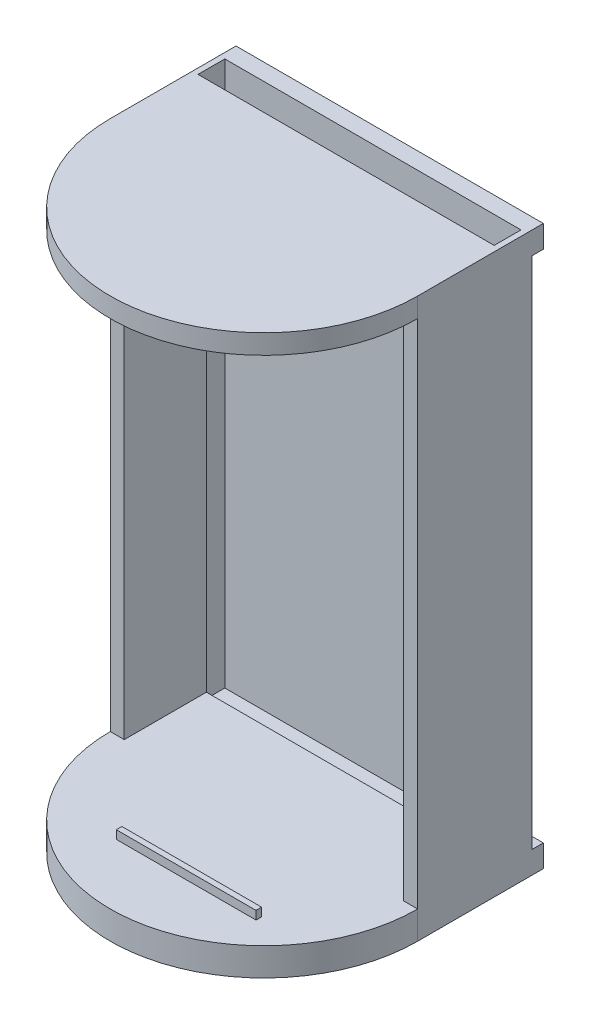
from build123d import *

# Parameters (mm, degrees)
SKETCH_14_W         = 110
SKETCH_14_H         = 200
EXTRUDE_11_DEPTH    = 15
SKETCH_15_W         = 5
SKETCH_15_H         = 200
EXTRUDE_12_DEPTH    = 30
EXTRUDE_14_DEPTH    = 10
EXTRUDE_15_DEPTH    = 7
SKETCH_19_W         = 4
SKETCH_19_H         = 184
CUT_EXTRUDE_1_DEPTH = 190.489445616
SKETCH_22_W         = 50
SKETCH_22_H         = 2
EXTRUDE_17_DEPTH    = 3
SKETCH_23_W         = 50
SKETCH_23_H         = 2
EXTRUDE_18_DEPTH    = 3
SKETCH_24_W         = 106
SKETCH_24_H         = 9.6
CUT_EXTRUDE_2_DEPTH = 195


with BuildPart() as part:
    # 草圖14 → 填料-伸長11 (new body)
    with BuildSketch(Plane.XY):
        with Locations((2.694256757, -17.5)):
            Rectangle(SKETCH_14_W, SKETCH_14_H)
    extrude(amount=EXTRUDE_11_DEPTH)

    # 草圖15 → 填料-伸長12 (add)
    with BuildSketch(Plane.XY.offset(15)):
        with Locations((-49.805743243, -17.5)):
            Rectangle(SKETCH_15_W, SKETCH_15_H)
        with Locations((55.194256757, -17.5)):
            Rectangle(SKETCH_15_W, SKETCH_15_H)
    extrude(amount=EXTRUDE_12_DEPTH)

    # 草圖18 → 填料-伸長15 (add)
    with BuildSketch(Plane(origin=(0, 82.5, 0), x_dir=(1, 0, 0), z_dir=(0, 1, 0))):
        with BuildLine():
            Line((-52.305743243, -15), (-52.305743243, -45))
            ThreePointArc((-52.305743243, -45), (2.694256757, -100), (57.694256757, -45))
            Line((57.694256757, -45), (57.694256757, -15))
            Line((57.694256757, -15), (-52.305743243, -15))
        make_face()
    extrude(amount=-EXTRUDE_15_DEPTH)

    # 草圖19 → 除料-伸長1 (cut, through all)
    with BuildSketch(Plane.ZY.offset(52.305743243)):
        with Locations((2, -17.5)):
            Rectangle(SKETCH_19_W, SKETCH_19_H)
    extrude(amount=-CUT_EXTRUDE_1_DEPTH, mode=Mode.SUBTRACT)


with BuildPart() as body_2:
    # 草圖17 → 填料-伸長14 (new body)
    with BuildSketch(Plane.XZ.offset(117.5)):
        with BuildLine():
            Line((-52.305743243, 15), (-52.305743243, 45))
            ThreePointArc((-52.305743243, 45), (2.694256757, 100), (57.694256757, 45))
            Line((57.694256757, 45), (57.694256757, 15))
            Line((57.694256757, 15), (-52.305743243, 15))
        make_face()
    extrude(amount=-EXTRUDE_14_DEPTH)


    add(part.part)  # 填料-伸長17 merges part
    # 草圖22 → 填料-伸長17 (add)
    with BuildSketch(Plane(origin=(0, -107.5, 0), x_dir=(1, 0, 0), z_dir=(0, 1, 0))):
        with Locations((7.194256757, -76.338233374)):
            Rectangle(SKETCH_22_W, SKETCH_22_H)
    extrude(amount=EXTRUDE_17_DEPTH)

    # 草圖23 → 填料-伸長18 (add)
    with BuildSketch(Plane.XZ.offset(-75.5)):
        with Locations((4.598650287, 76.338233374)):
            Rectangle(SKETCH_23_W, SKETCH_23_H)
    extrude(amount=EXTRUDE_18_DEPTH)

    # 草圖24 → 除料-伸長2 (cut)
    with BuildSketch(Plane(origin=(0, 82.5, 0), x_dir=(1, 0, 0), z_dir=(0, 1, 0))):
        with Locations((2.694256757, -10.8)):
            Rectangle(SKETCH_24_W, SKETCH_24_H)
    extrude(amount=-CUT_EXTRUDE_2_DEPTH, mode=Mode.SUBTRACT)


solid = body_2.part
